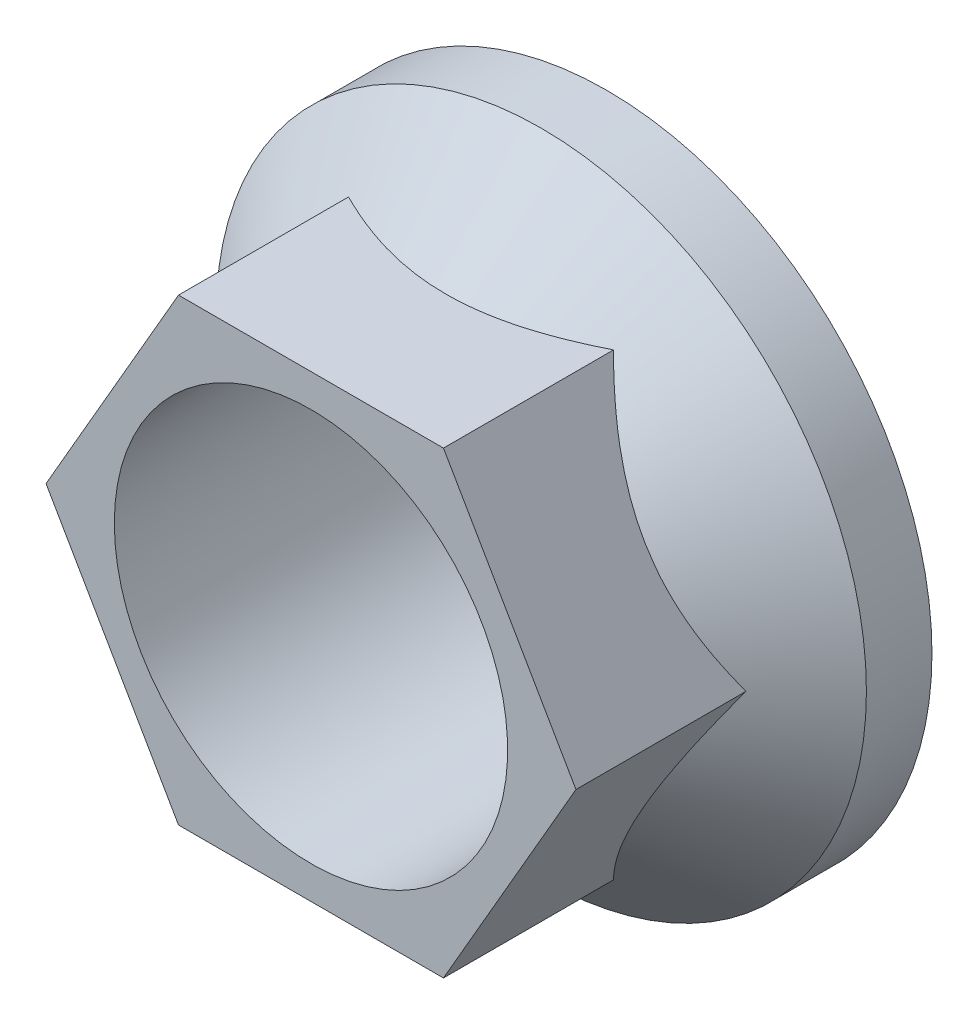
from build123d import *

# Parameters (mm, degrees)
BOSS_EXTRUDE1_REACH = 15.24
SKETCH2_R           = 4.7625


with BuildPart() as part:
    # Sketch1 → Revolve1 (revolve)
    with BuildSketch(Plane(origin=(0, 0, 0), x_dir=(0, 0, -1), z_dir=(1, 0, 0)), mode=Mode.PRIVATE) as revolve1_sk:
        Polygon((0, 4.7625), (-7.1628, 4.7625), (-7.1628, 5.55625), (-3.90525, 5.55625), (-1.5875, 7.874), (0, 7.874), align=None)
    revolve(revolve1_sk.sketch.rotate(Axis((0, 0, 0), (0, 0, 1)), 90), axis=Axis((0, 0, 0), (0, 0, 1)))

    # Boss-Extrude1: up to this cone (the profile starts outside it)
    boss_extrude1_end = Plane(origin=(0, 0, 7.1628), z_dir=(0, 0, -1)).offset(-2.298699) * Cone(1e-06, 20.3374, 20.337399, align=(Align.CENTER, Align.CENTER, Align.MIN), mode=Mode.PRIVATE)
    # Sketch2 → Boss-Extrude1 (add, up to the surface)
    with BuildSketch(Plane.XY.offset(7.1628), mode=Mode.PRIVATE) as boss_extrude1_sk1:
        Polygon((-3.207902433, 5.55625), (-6.415804866, 0), (-3.207902433, -5.55625), (3.207902433, -5.55625), (6.415804866, 0), (3.207902433, 5.55625), align=None)
        with Locations(Location((0, 0, 0), (0, 0, 180))):
            Circle(SKETCH2_R, mode=Mode.SUBTRACT)
    boss_extrude1_tool1 = extrude(boss_extrude1_sk1.sketch, amount=-BOSS_EXTRUDE1_REACH, mode=Mode.PRIVATE) - boss_extrude1_end
    add(boss_extrude1_tool1.solids().sort_by_distance((-4.664849, 2.693252, 7.1628))[0])


solid = part.part
